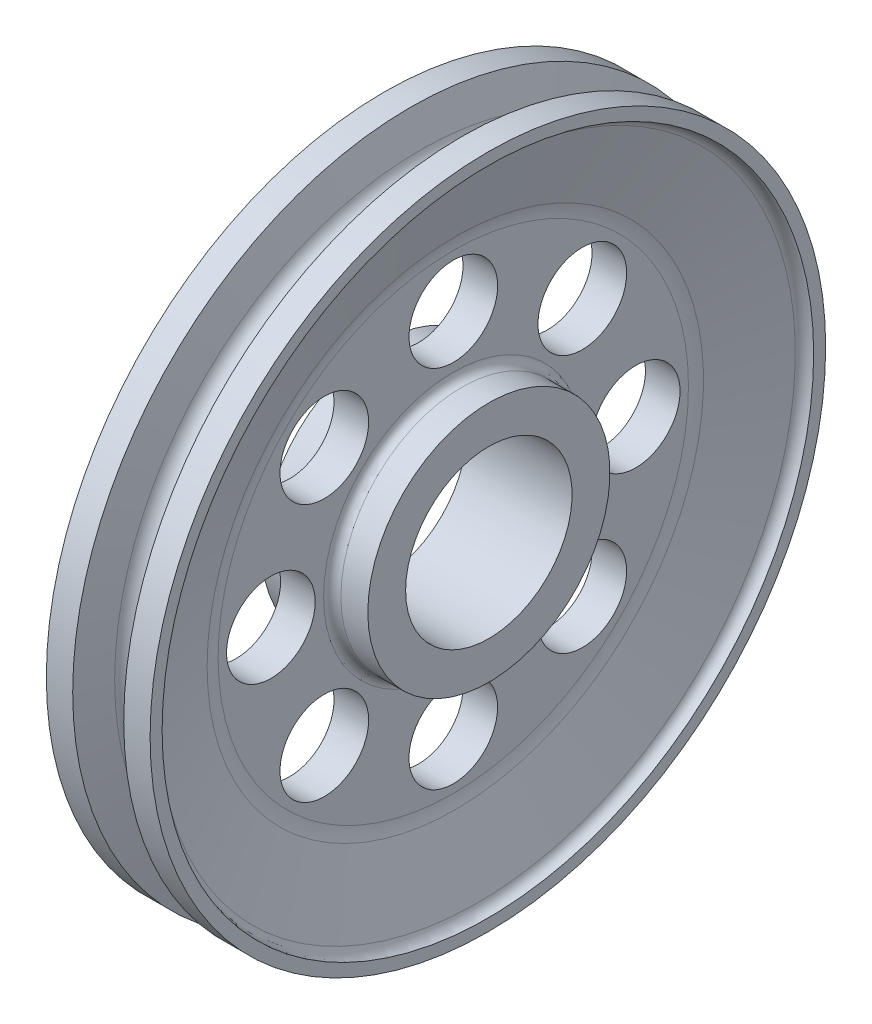
from build123d import *
from build123d.topology import SkipClean

# Parameters (mm, degrees)
FORO_START        = 60
SKETCH2_R         = 41
FORO_DEPTH        = 120
PATTERNFORI_COUNT = 8


with BuildPart() as part:
    # Sketch1 → Puleggia (revolve)
    with BuildSketch(Plane.XY):
        with BuildLine():
            Line((14.305754261, 90.102284872), (23.610406599, 119.612871865))
            Line((23.610406599, 119.612871865), (48, 119.612871865))
            Line((48, 119.612871865), (48, 108.49032691))
            ThreePointArc((48, 108.49032691), (41.937089486, 106.505733817), (38.221197059, 101.320211941))
            Line((38.221197059, 101.320211941), (17.85132197, 36.715221983))
            ThreePointArc((17.85132197, 36.715221983), (16.465539581, 30.77192545), (16, 24.686990003))
            Line((16, 24.686990003), (16, -72.887128135))
            ThreePointArc((16, -72.887128135), (18.343145751, -78.543982385), (24, -80.887128135))
            Line((24, -80.887128135), (48.9, -80.887128135))
            Line((48.9, -80.887128135), (48.9, -115.887128135))
            Line((48.9, -115.887128135), (0, -115.887128135))
            Line((0, -115.887128135), (0, 79.612871865))
            ThreePointArc((0, 79.612871865), (8.869644725, 82.516202801), (14.305754261, 90.102284872))
        make_face()
    puleggia = revolve(axis=Axis((-62.254886415, -192.887128135, 0), (1, 0, 0)))

    # Mirror 2: Puleggia across plane
    with SkipClean():  # the faces are left unmerged after this step: merging them gives an invalid solid
        add(puleggia.mirror(Plane(origin=(0, 79.612871865, 0), x_dir=(0, 0, 1), z_dir=(1, 0, 0))))

    # Sketch2 → Foro (cut)
    with SkipClean():  # the faces are left unmerged after this step: merging them gives an invalid solid
        with BuildSketch(Plane(origin=(0, 0, 0), x_dir=(0, 0, -1), z_dir=(1, 0, 0)).offset(FORO_START)):
            with Locations((0, -24.100069066)):
                Circle(SKETCH2_R)
        foro = extrude(amount=-FORO_DEPTH, mode=Mode.SUBTRACT)

    # PatternFori: Foro ×8 about axis
    with SkipClean():  # the faces are left unmerged after this step: merging them gives an invalid solid
        patternfori_axis = Axis((48.9, -192.887128135, 0), (-1, 0, 0))
        for i in range(1, PATTERNFORI_COUNT):
            add(foro.rotate(patternfori_axis, i * 360 / PATTERNFORI_COUNT), mode=Mode.SUBTRACT)


solid = part.part
